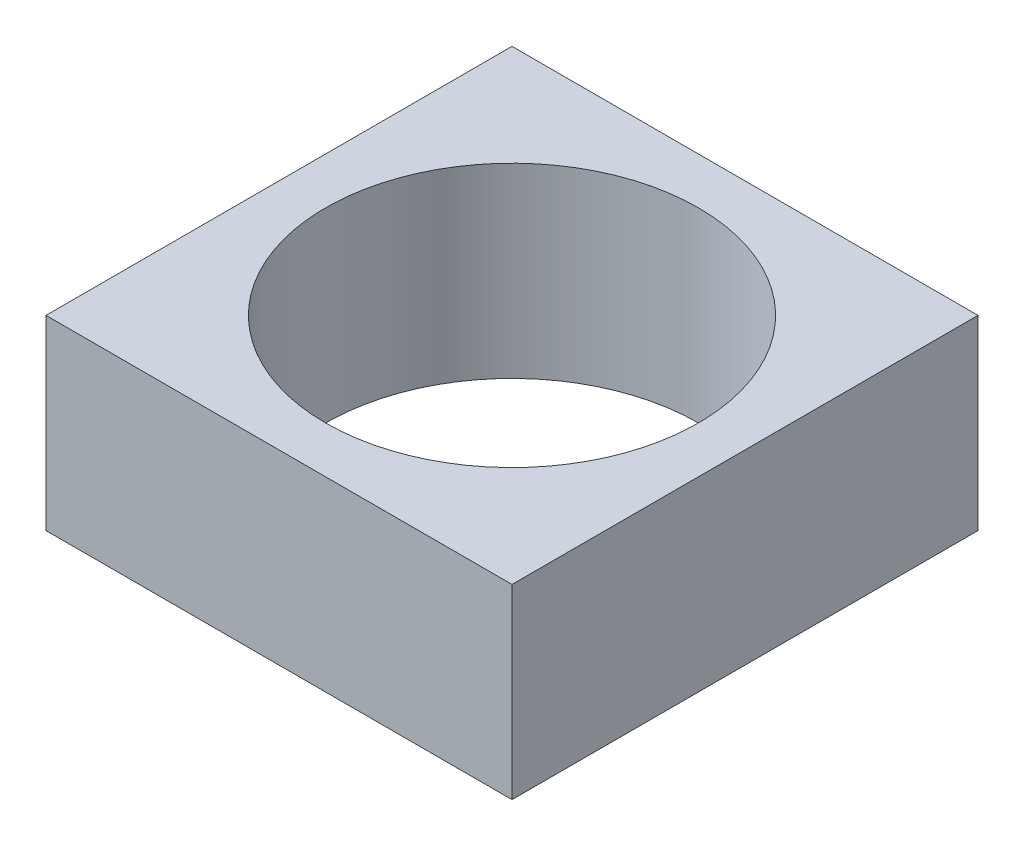
from build123d import *

# Parameters (mm, degrees)
SKETCH1_W           = 50
SKETCH1_H           = 50
SKETCH1_R           = 20
BOSS_EXTRUDE1_DEPTH = 20


with BuildPart() as part:
    # Sketch1 → Boss-Extrude1 (new body)
    with BuildSketch(Plane(origin=(0, 0, 0), x_dir=(1, 0, 0), z_dir=(0, 1, 0))):
        Rectangle(SKETCH1_W, SKETCH1_H)
        with Locations(Location((0, 0, 0), (0, 0, 270))):
            Circle(SKETCH1_R, mode=Mode.SUBTRACT)
    extrude(amount=BOSS_EXTRUDE1_DEPTH)


solid = part.part
